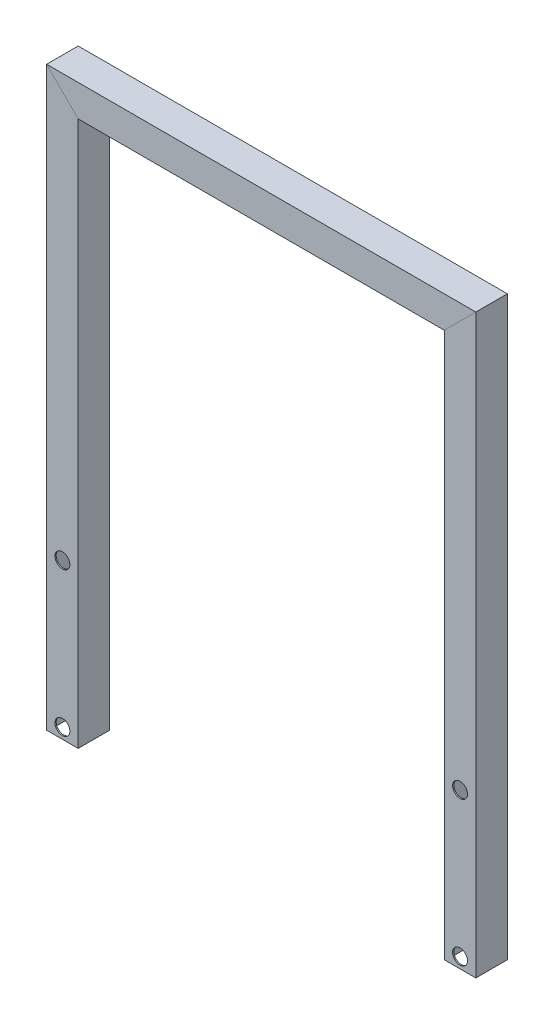
from build123d import *

# Parameters (mm, degrees)
SKETCH1_ON_SEGMENT_1_W                   = 25.4
SKETCH1_ON_SEGMENT_1_H                   = 25.4
SKETCH1_ON_SEGMENT_1_W_2                 = 23.4
SKETCH1_ON_SEGMENT_1_H_2                 = 23.4
SQURE_TUBE_1X1SQUARE_TUBE_1_DEPTH        = 470.382821159
SKETCH1_ON_SEGMENT_2_W                   = 25.4
SKETCH1_ON_SEGMENT_2_H                   = 25.4
SKETCH1_ON_SEGMENT_2_W_2                 = 23.4
SKETCH1_ON_SEGMENT_2_H_2                 = 23.4
SQURE_TUBE_1X1SQUARE_TUBE_1_2_DEPTH      = 357.921024484
SQURE_TUBE_1X1SQUARE_TUBE_1_3_DEPTH      = 451.422308917
SQURE_TUBE_1X1SQUARE_TUBE_1_3_DEPTH_BACK = 18.960512242
SKETCH1_W                                = 25.4
SKETCH1_H                                = 25.4
SKETCH1_W_2                              = 23.4
SKETCH1_H_2                              = 23.4
CUT_EXTRUDE1_DEPTH                       = 572.615226909
CUT_EXTRUDE1_DEPTH_BACK                  = 572.615226909
SKETCH2_R                                = 6


with BuildPart() as part:
    # Sketch1 on segment 1 (carried to segment 1) → Squre tube 1X1SQUARE TUBE(1) (new body)
    with BuildSketch(Plane(origin=(0, 0, 0), x_dir=(-1, 0, 0), z_dir=(0, 1, 0))):
        Rectangle(SKETCH1_ON_SEGMENT_1_W, SKETCH1_ON_SEGMENT_1_H)
        Rectangle(SKETCH1_ON_SEGMENT_1_W_2, SKETCH1_ON_SEGMENT_1_H_2, mode=Mode.SUBTRACT)
    extrude(amount=SQURE_TUBE_1X1SQUARE_TUBE_1_DEPTH)

    # Squre tube 1X1SQUARE TUBE(1) mitre 1
    split(bisect_by=Plane(origin=(0, 451.422308917, 0), x_dir=(0.707106781, -0.707106781, 0), z_dir=(-0.707106781, -0.707106781, 0)), keep=Keep.TOP)


with BuildPart() as body_2:
    # Sketch1 on segment 2 (carried to segment 2) → Squre tube 1X1SQUARE TUBE_1 2 (new body)
    with BuildSketch(Plane(origin=(-18.960512242, 451.422308917, 0), x_dir=(0, 1, 0), z_dir=(1, 0, 0))):
        Rectangle(SKETCH1_ON_SEGMENT_2_W, SKETCH1_ON_SEGMENT_2_H)
        Rectangle(SKETCH1_ON_SEGMENT_2_W_2, SKETCH1_ON_SEGMENT_2_H_2, mode=Mode.SUBTRACT)
    extrude(amount=SQURE_TUBE_1X1SQUARE_TUBE_1_2_DEPTH)

    # Squre tube 1X1SQUARE TUBE_1 2 mitre 1
    split(bisect_by=Plane(origin=(0, 451.422308917, 0), x_dir=(-0.707106781, 0.707106781, 0), z_dir=(0.707106781, 0.707106781, 0)), keep=Keep.TOP)

    # Squre tube 1X1SQUARE TUBE_1 2 mitre 2
    split(bisect_by=Plane(origin=(320, 451.422308917, 0), x_dir=(-0.707106781, -0.707106781, 0), z_dir=(-0.707106781, 0.707106781, 0)), keep=Keep.TOP)


with BuildPart() as body_3:
    # Sketch1 → Squre tube 1X1SQUARE TUBE_1 3 (new, two sides: drawn at the far end of the back side and taken through both)
    with BuildSketch(Plane(origin=(320, 451.422308917, 0), x_dir=(1, 0, 0), z_dir=(0, -1, 0)).offset(-SQURE_TUBE_1X1SQUARE_TUBE_1_3_DEPTH_BACK)):
        Rectangle(SKETCH1_W, SKETCH1_H)
        Rectangle(SKETCH1_W_2, SKETCH1_H_2, mode=Mode.SUBTRACT)
    extrude(amount=SQURE_TUBE_1X1SQUARE_TUBE_1_3_DEPTH + SQURE_TUBE_1X1SQUARE_TUBE_1_3_DEPTH_BACK)

    # Squre tube 1X1SQUARE TUBE_1 3 mitre 1
    split(bisect_by=Plane(origin=(320, 451.422308917, 0), x_dir=(0.707106781, 0.707106781, 0), z_dir=(0.707106781, -0.707106781, 0)), keep=Keep.TOP)


with BuildPart() as cut_extrude1_tool:
    # Sketch2 → Cut-Extrude1 (new, two sides: drawn at the far end of the back side and taken through both)
    with BuildSketch(Plane.XY.offset(12.7).offset(-CUT_EXTRUDE1_DEPTH_BACK)):
        with Locations((320, 124.72575792)):
            Circle(SKETCH2_R)
        with Locations((320, 8.589481736)):
            Circle(SKETCH2_R)
        with Locations((0, 8.589481736)):
            Circle(SKETCH2_R)
        with Locations((0, 124.72575792)):
            Circle(SKETCH2_R)
    extrude(amount=CUT_EXTRUDE1_DEPTH + CUT_EXTRUDE1_DEPTH_BACK)


with BuildPart() as part_1:
    add(part.part)

    # Cut-Extrude1: cut by cut_extrude1_tool
    add(cut_extrude1_tool.part, mode=Mode.SUBTRACT)


with BuildPart() as body_3_1:
    add(body_3.part)

    # Cut-Extrude1: cut by cut_extrude1_tool
    add(cut_extrude1_tool.part, mode=Mode.SUBTRACT)


solid = Compound([body_2.part, part_1.part, body_3_1.part])
